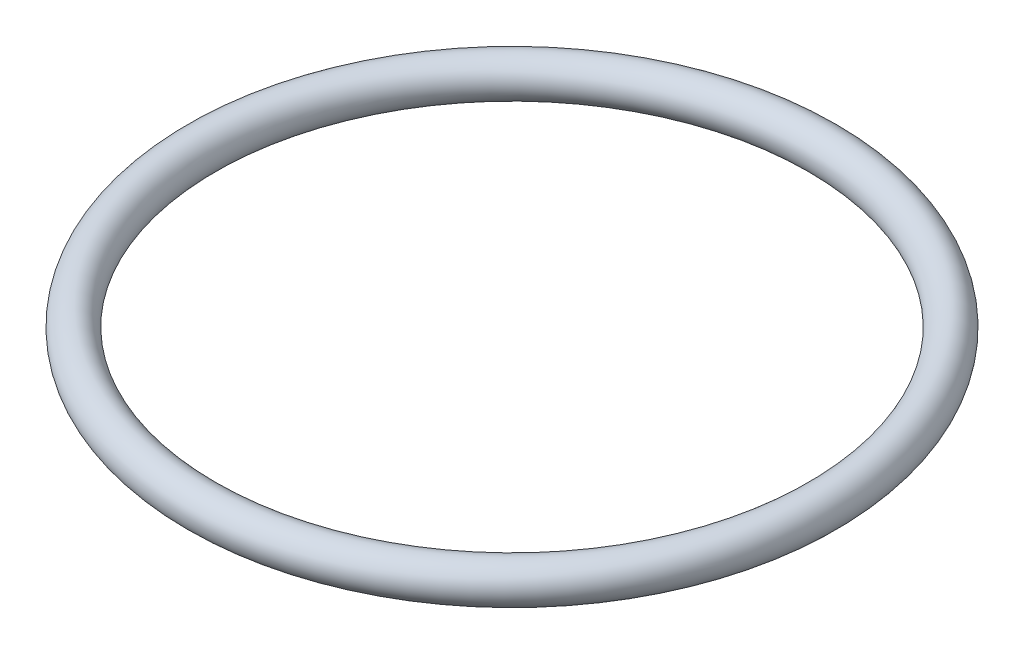
from build123d import *

# Parameters (mm, degrees)
SKETCH1_R = 2.5


with BuildPart() as part:
    # Sketch1 → Revolve1 (revolve)
    with BuildSketch(Plane.XY, mode=Mode.PRIVATE) as revolve1_sk:
        with Locations((40, 0)):
            Circle(SKETCH1_R)
    revolve(revolve1_sk.sketch.rotate(Axis((0, 0, 0), (0, 1, 0)), 90), axis=Axis((0, 0, 0), (0, 1, 0)))


solid = part.part
